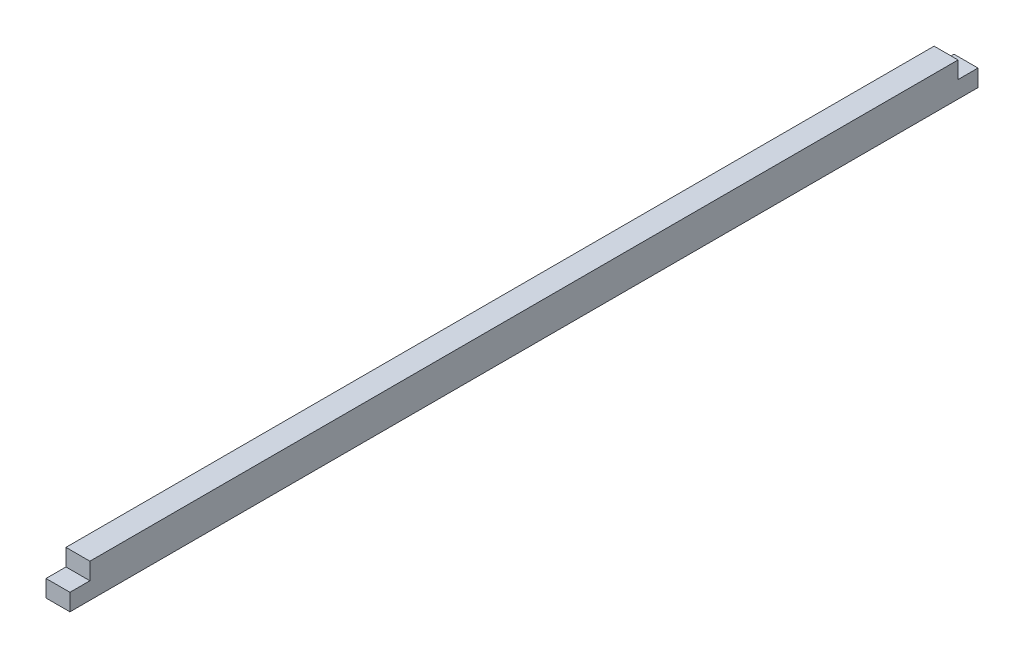
from build123d import *

# Parameters (mm, degrees)
SKETCH1_W           = 455
SKETCH1_H           = 17
BOSS_EXTRUDE1_DEPTH = 12
SKETCH2_W           = 10
SKETCH2_H           = 8.5
CUT_EXTRUDE1_DEPTH  = 12


with BuildPart() as part:
    # Sketch1 → Boss-Extrude1 (new body)
    with BuildSketch(Plane(origin=(0, 0, 0), x_dir=(0, 0, -1), z_dir=(1, 0, 0))):
        with Locations((227.5, 8.5)):
            Rectangle(SKETCH1_W, SKETCH1_H)
    extrude(amount=BOSS_EXTRUDE1_DEPTH)

    # Sketch2 → Cut-Extrude1 (cut)
    with BuildSketch(Plane(origin=(12, 0, 0), x_dir=(0, 0, -1), z_dir=(1, 0, 0))):
        with Locations((5, 12.75)):
            Rectangle(SKETCH2_W, SKETCH2_H)
        with Locations((450, 12.75)):
            Rectangle(SKETCH2_W, SKETCH2_H)
    extrude(amount=-CUT_EXTRUDE1_DEPTH, mode=Mode.SUBTRACT)


solid = part.part
